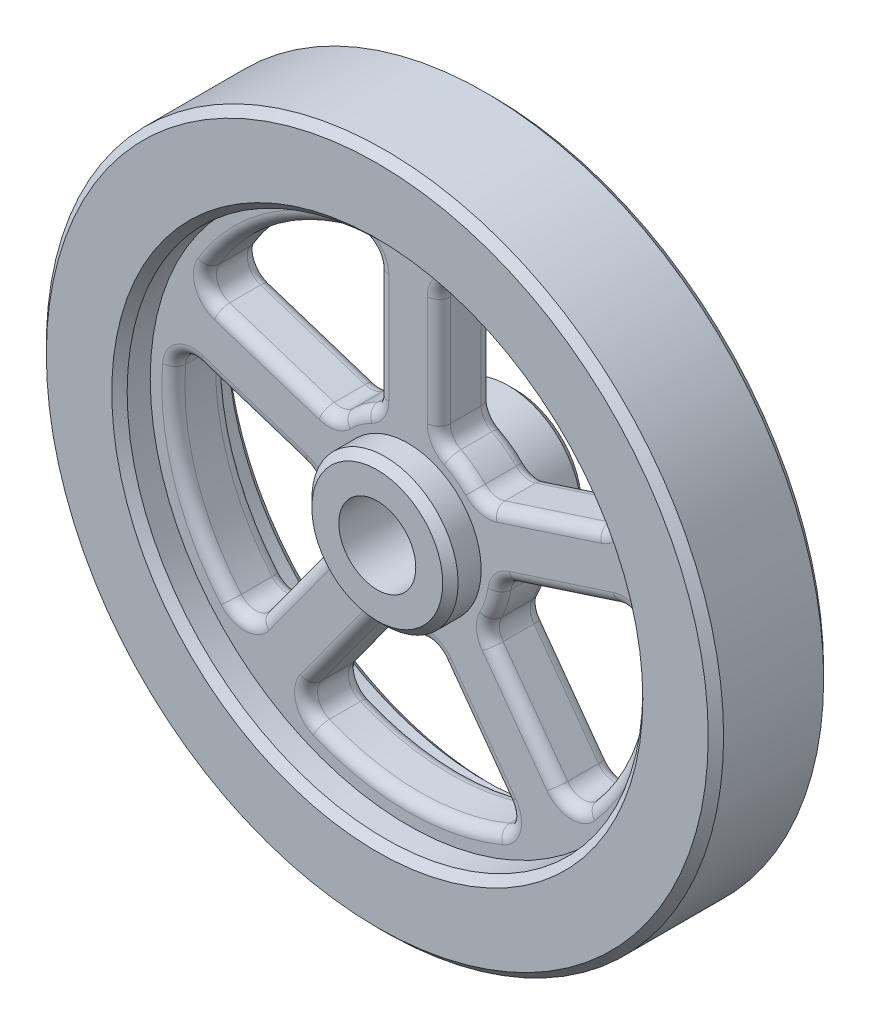
from build123d import *

# Parameters (mm, degrees)
SKETCH1_R           = 44
SKETCH1_R_2         = 33.5
BOSS_EXTRUDE1_DEPTH = 7.5
SKETCH2_R           = 33.5
BOSS_EXTRUDE2_DEPTH = 3.5
SKETCH3_R           = 5
CUT_EXTRUDE1_DEPTH  = 64.190189112
CHAMFER1_SIZE       = 1
CUT_EXTRUDE2_DEPTH  = 64.190189112
CIRPATTERN1_COUNT   = 5
SKETCH6_R           = 9.5
BOSS_EXTRUDE3_DEPTH = 18
SKETCH7_R           = 5
CUT_EXTRUDE3_DEPTH  = 65.776538963
CHAMFER2_SIZE       = 1
FILLET1_R           = 2.5
FILLET2_R           = 1.5
FILLET3_R           = 1.5


with BuildPart() as part:
    # Sketch1 → Boss-Extrude1 (new, symmetric)
    with BuildSketch(Plane.XY):
        Circle(SKETCH1_R)
        Circle(SKETCH1_R_2, mode=Mode.SUBTRACT)
    extrude(amount=BOSS_EXTRUDE1_DEPTH, both=True)

    # Sketch2 → Boss-Extrude2 (add, symmetric)
    with BuildSketch(Plane.XY):
        Circle(SKETCH2_R)
    extrude(amount=BOSS_EXTRUDE2_DEPTH, both=True)

    # Sketch3 → Cut-Extrude1 (cut, through all)
    with BuildSketch(Plane.XY.offset(3.5)):
        Circle(SKETCH3_R)
    extrude(amount=-CUT_EXTRUDE1_DEPTH, mode=Mode.SUBTRACT)

    # Chamfer1
    chamfer1_edges = [part.edges().sort_by_distance(p)[0] for p in [
        (-44, 0, -7.5),
        (-44, 0, 7.5),
        (-33.5, 0, -7.5),
        (-33.5, 0, 7.5),
    ]]
    chamfer(chamfer1_edges, length=CHAMFER1_SIZE)

    # Sketch5 → Cut-Extrude2 (cut, through all)
    with BuildSketch(Plane.XY.offset(3.5)):
        with BuildLine():
            Line((4, 11.313708499), (4, 30.236567265))
            ThreePointArc((4, 30.236567265), (17.927450195, 24.675018328), (27.520616351, 13.147839202))
            Line((27.520616351, 13.147839202), (9.523908214, 7.300354261))
            ThreePointArc((9.523908214, 7.300354261), (7.053423028, 9.708203932), (4, 11.313708499))
        make_face()
    cut_extrude2 = extrude(amount=-CUT_EXTRUDE2_DEPTH, mode=Mode.SUBTRACT)

    # CirPattern1: Cut-Extrude2 ×5 about axis
    cirpattern1_axis = Axis((0, 0, 0), (0, 0, 1))
    for i in range(1, CIRPATTERN1_COUNT):
        add(cut_extrude2.rotate(cirpattern1_axis, i * 360 / CIRPATTERN1_COUNT), mode=Mode.SUBTRACT)

    # Sketch6 → Boss-Extrude3 (add)
    with BuildSketch(Plane.XY.offset(7.5)):
        Circle(SKETCH6_R)
    extrude(amount=-BOSS_EXTRUDE3_DEPTH)

    # Sketch7 → Cut-Extrude3 (cut, through all)
    with BuildSketch(Plane.XY.offset(7.5)):
        Circle(SKETCH7_R)
    extrude(amount=-CUT_EXTRUDE3_DEPTH, mode=Mode.SUBTRACT)

    # Chamfer2
    chamfer2_edges = [part.edges().sort_by_distance(p)[0] for p in [
        (-9.5, 0, -10.5),
        (-9.5, 0, 7.5),
    ]]
    chamfer(chamfer2_edges, length=CHAMFER2_SIZE)

    # Fillet1
    fillet1_edges = [part.edges().sort_by_distance(p)[0] for p in [
        (4, 30.236567265, 0),
        (27.520616351, 13.147839202, 0),
        (9.523908214, 7.300354261, 0),
        (4, 11.313708499, 0),
        (-27.520616351, 13.147839202, 0),
        (-4, 30.236567265, 0),
        (-4, 11.313708499, 0),
        (-9.523908214, 7.300354261, 0),
        (29.992752306, 5.539387071, 0),
        (21.008676296, -22.11075576, 0),
        (9.886098982, -6.801841436, 0),
        (11.996044169, -0.30809787, 0),
        (-21.008676296, -22.11075576, 0),
        (-29.992752306, 5.539387071, 0),
        (-11.996044169, -0.30809787, 0),
        (-9.886098982, -6.801841436, 0),
        (14.536540341, -26.813037779, 0),
        (-14.536540341, -26.813037779, 0),
        (-3.413963027, -11.504123454, 0),
        (3.413963027, -11.504123454, 0),
    ]]
    fillet(fillet1_edges, radius=FILLET1_R)

    # Fillet2
    fillet2_edges = [part.edges().sort_by_distance(p)[0] for p in [
        (17.878536491, 10.014937543, 3.5),
        (17.878536491, 10.014937543, -3.5),
        (7.053423028, 9.708203932, 3.5),
        (7.053423028, 9.708203932, -3.5),
        (4, 20.09828453, 3.5),
        (4, 20.09828453, -3.5),
        (17.927450195, 24.675018328, 3.5),
        (17.927450195, 24.675018328, -3.5),
        (9.727097522, 7.758141556, 3.5),
        (9.727097522, 7.758141556, -3.5),
        (4.372592642, 11.648417068, 3.5),
        (4.372592642, 11.648417068, -3.5),
        (4.950950752, 29.197343107, 3.5),
        (4.950950752, 29.197343107, -3.5),
        (26.2383955, 13.731109186, 3.5),
        (26.2383955, 13.731109186, -3.5),
    ]]
    fillet(fillet2_edges, radius=FILLET2_R)

    # Fillet3
    fillet3_edges = [part.edges().sort_by_distance(p)[0] for p in [
        (-17.878536491, 10.014937543, 3.5),
        (-17.878536491, 10.014937543, -3.5),
        (-17.927450195, 24.675018328, 3.5),
        (-17.927450195, 24.675018328, -3.5),
        (-4, 20.09828453, 3.5),
        (-4, 20.09828453, -3.5),
        (-29.007223747, -9.425018328, 3.5),
        (-29.007223747, -9.425018328, -3.5),
        (-20.350672446, 2.406485412, 3.5),
        (-20.350672446, 2.406485412, -3.5),
        (-7.053423028, 9.708203932, 3.5),
        (-7.053423028, 9.708203932, -3.5),
        (-15.04954322, -13.908712733, 3.5),
        (-15.04954322, -13.908712733, -3.5),
        (-11.412678196, -3.708203932, 3.5),
        (-11.412678196, -3.708203932, -3.5),
        (-8.577407265, -18.610994752, 3.5),
        (-8.577407265, -18.610994752, -3.5),
        (0, -12, 3.5),
        (0, -12, -3.5),
        (8.577407265, -18.610994752, 3.5),
        (8.577407265, -18.610994752, -3.5),
        (0, -30.5, 3.5),
        (0, -30.5, -3.5),
        (15.04954322, -13.908712733, 3.5),
        (15.04954322, -13.908712733, -3.5),
        (11.412678196, -3.708203932, 3.5),
        (11.412678196, -3.708203932, -3.5),
        (29.007223747, -9.425018328, 3.5),
        (29.007223747, -9.425018328, -3.5),
        (20.350672446, 2.406485412, 3.5),
        (20.350672446, 2.406485412, -3.5),
        (-26.2383955, 13.731109186, 3.5),
        (-26.2383955, 13.731109186, -3.5),
        (-4.950950752, 29.197343107, 3.5),
        (-4.950950752, 29.197343107, -3.5),
        (-29.298251341, 4.313841236, 3.5),
        (-29.298251341, 4.313841236, -3.5),
        (-4.372592642, 11.648417068, 3.5),
        (-4.372592642, 11.648417068, -3.5),
        (-9.727097522, 7.758141556, 3.5),
        (-9.727097522, 7.758141556, -3.5),
        (-21.167170981, -20.711050927, 3.5),
        (-21.167170981, -20.711050927, -3.5),
        (-10.384269522, -6.853621897, 3.5),
        (-10.384269522, -6.853621897, -3.5),
        (-12.429508393, -0.559023893, 3.5),
        (-12.429508393, -0.559023893, -3.5),
        (-3.309266009, -11.993912835, 3.5),
        (-3.309266009, -11.993912835, -3.5),
        (3.309266009, -11.993912835, 3.5),
        (3.309266009, -11.993912835, -3.5),
        (13.156364387, -26.531242601, 3.5),
        (13.156364387, -26.531242601, -3.5),
        (-13.156364387, -26.531242601, 3.5),
        (-13.156364387, -26.531242601, -3.5),
        (10.384269522, -6.853621897, 3.5),
        (10.384269522, -6.853621897, -3.5),
        (21.167170981, -20.711050927, 3.5),
        (21.167170981, -20.711050927, -3.5),
        (29.298251341, 4.313841236, 3.5),
        (29.298251341, 4.313841236, -3.5),
        (12.429508393, -0.559023893, 3.5),
        (12.429508393, -0.559023893, -3.5),
    ]]
    fillet(fillet3_edges, radius=FILLET3_R)


solid = part.part
